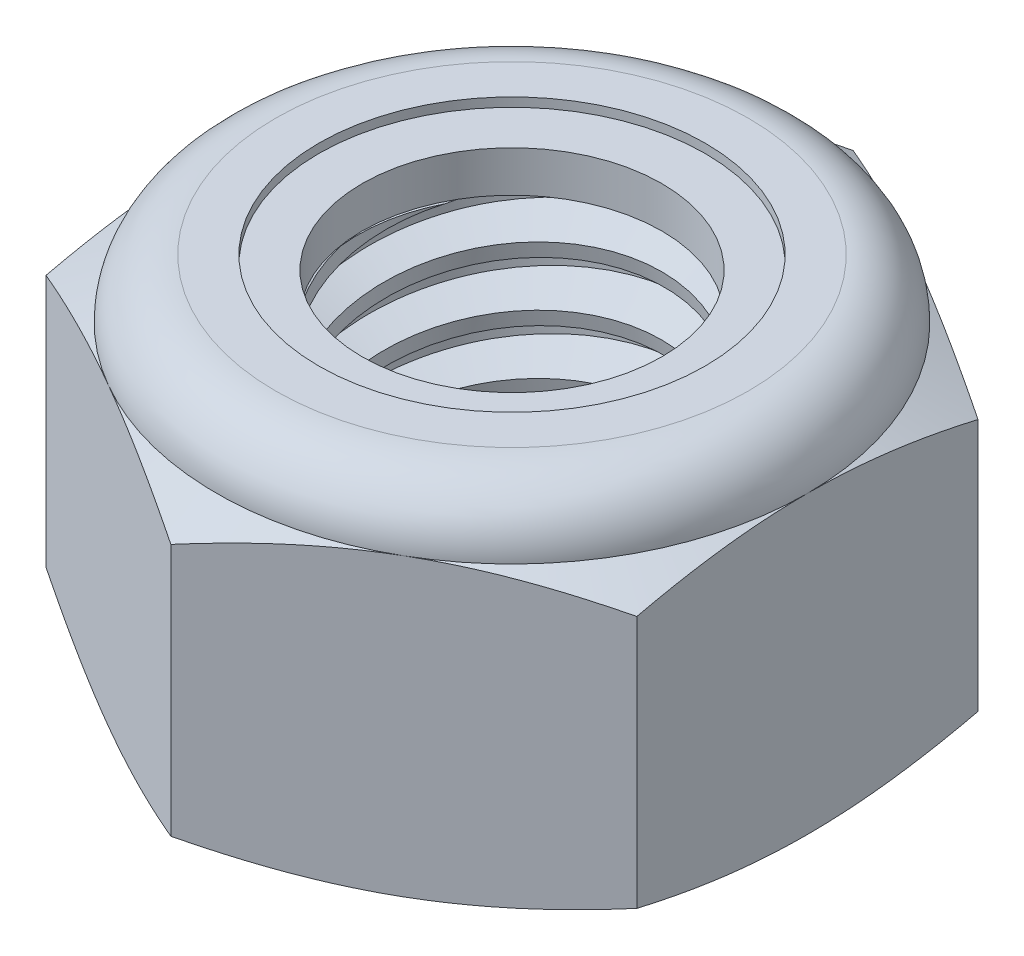
from build123d import *

# Parameters (mm, degrees)
EXTRUDE1_DEPTH      = 6
SKETCH2_W           = 3
SKETCH2_H           = 6
LPATTERN1_COUNT     = 6
LPATTERN1_PITCH     = 1
LPATTERN1_COL_COUNT = 2
LPATTERN1_COL_PITCH = 1


with BuildPart() as part:
    # Sketch1 → Extrude1 (new body)
    with BuildSketch(Plane(origin=(0, 0, 0), x_dir=(1, 0, 0), z_dir=(0, 1, 0))):
        Polygon((0, 5.773502692), (-5, 2.886751346), (-5, -2.886751346), (0, -5.773502692), (5, -2.886751346), (5, 2.886751346), align=None)
    extrude(amount=EXTRUDE1_DEPTH)

    # Sketch4 → Cut-Revolve2 (revolve, cut)
    with BuildSketch(Plane(origin=(0, 0, 0), x_dir=(0, 0, -1), z_dir=(1, 0, 0)), mode=Mode.PRIVATE) as cut_revolve2_sk:
        Polygon((0, 6), (3, 6), (2.538023184, 5.784576673), (2.538023184, 0.215423327), (3, 0), (0, 0), align=None)
    revolve(cut_revolve2_sk.sketch.rotate(Axis((0, 6, 0), (0, 1, 0)), 55.157981045), axis=Axis((0, 6, 0), (0, 1, 0)), mode=Mode.SUBTRACT)


with BuildPart() as body_2:
    # Sketch2 → Revolve1 (revolve)
    with BuildSketch(Plane(origin=(0, 0, 0), x_dir=(0, 0, -1), z_dir=(1, 0, 0))):
        with Locations((1.5, 3)):
            Rectangle(SKETCH2_W, SKETCH2_H)
    revolve(axis=Axis((0, -3, 0), (0, 1, 0)))

    # Sketch3 → Cut-Revolve1 (revolve, cut)
    with BuildSketch(Plane(origin=(0, 0, 0), x_dir=(0, 0, -1), z_dir=(1, 0, 0)), mode=Mode.PRIVATE) as cut_revolve1_sk:
        Polygon((3.020549873, 5.87670076), (3.164398987, 5.013606076), (2.579122931, 5.232870615), (2.538023184, 5.479469096), align=None)
    cut_revolve1 = revolve(cut_revolve1_sk.sketch.rotate(Axis((0, 6, 0.178376498), (0, -0.9863939238321437, -0.16439898730535757)), 180), axis=Axis((0, 6, 0.178376498), (0, -0.9863939238321437, -0.16439898730535757)), mode=Mode.SUBTRACT)

    # LPattern1: Cut-Revolve1 ×6
    with Locations(*[(0, -i * LPATTERN1_PITCH, 0) for i in range(1, LPATTERN1_COUNT)]):
        add(cut_revolve1, mode=Mode.SUBTRACT)

    # LPattern1 col: Cut-Revolve1 ×2
    with Locations(*[(0, i * LPATTERN1_COL_PITCH, 0) for i in range(1, LPATTERN1_COL_COUNT)]):
        add(cut_revolve1, mode=Mode.SUBTRACT)


with BuildPart() as part_1:
    add(part.part)

    # Combine1: cut body 2
    add(body_2.part, mode=Mode.SUBTRACT)

    # Sketch5 → Cut-Revolve3 (revolve, cut)
    with BuildSketch(Plane(origin=(0, 0, 0), x_dir=(0, 0, -1), z_dir=(1, 0, 0)), mode=Mode.PRIVATE) as cut_revolve3_sk:
        with BuildLine():
            Line((0, 0), (5, 0))
            Line((5, 0), (5.773502692, 0.360690229))
            Line((5.773502692, 0.360690229), (5.773502692, 4.639309771))
            Line((5.773502692, 4.639309771), (5, 5))
            ThreePointArc((5, 5), (4.707106781, 5.707106781), (4, 6))
            Line((4, 6), (4, 7.27))
            Line((4, 7.27), (7.043502692, 7.27))
            Line((7.043502692, 7.27), (7.043502692, -1.27))
            Line((7.043502692, -1.27), (0, -1.27))
            Line((0, -1.27), (0, 0))
        make_face()
    revolve(cut_revolve3_sk.sketch.rotate(Axis((0, 0, 0), (0, 1, 0)), 55.157981045), axis=Axis((0, 0, 0), (0, 1, 0)), mode=Mode.SUBTRACT)

    # Sketch6 → Cut-Revolve4 (revolve, cut)
    with BuildSketch(Plane(origin=(0, 0, 0), x_dir=(0, 0, -1), z_dir=(1, 0, 0)), mode=Mode.PRIVATE) as cut_revolve4_sk:
        with BuildLine():
            Line((0, 5), (4.8476, 5))
            ThreePointArc((4.8476, 5), (4.599343708, 5.599343708), (4, 5.8476))
            Line((4, 5.8476), (3.269011592, 5.8476))
            Line((3.269011592, 5.8476), (3.269011592, 7.27))
            Line((3.269011592, 7.27), (0, 7.27))
            Line((0, 7.27), (0, 5))
        make_face()
    revolve(cut_revolve4_sk.sketch.rotate(Axis((0, 7.27, 0), (0, 1, 0)), 32.153394979), axis=Axis((0, 7.27, 0), (0, 1, 0)), mode=Mode.SUBTRACT)


with BuildPart() as body_2_2:
    # Sketch7 → Revolve2 (revolve)
    with BuildSketch(Plane(origin=(0, 0, 0), x_dir=(0, 0, -1), z_dir=(1, 0, 0))):
        with BuildLine():
            Line((2.538023184, 5.0762), (4.767627201, 5.0762))
            ThreePointArc((4.767627201, 5.0762), (4.51782105, 5.57176859), (4, 5.7714))
            Line((4, 5.7714), (2.538023184, 5.7714))
            Line((2.538023184, 5.7714), (2.538023184, 5.0762))
        make_face()
    revolve(axis=Axis((0, 5.0762, 0), (0, 1, 0)))


solid = Compound([part_1.part, body_2_2.part])
